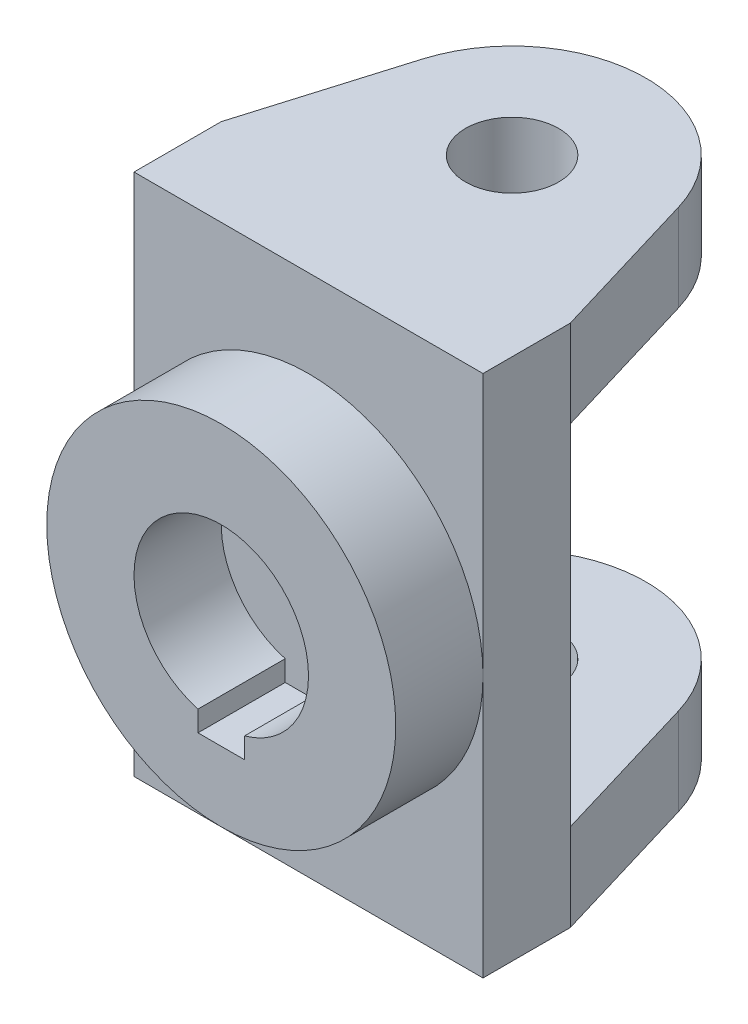
from build123d import *

# Parameters (mm, degrees)
SKETCH1_W           = 60
SKETCH1_H           = 90
BOSS_EXTRUDE1_DEPTH = 15
SKETCH2_R           = 30
BOSS_EXTRUDE2_DEPTH = 15
SKETCH3_R           = 8
BOSS_EXTRUDE3_DEPTH = 15


with BuildPart() as part:
    # Sketch1 → Boss-Extrude1 (new body)
    with BuildSketch(Plane.XY):
        Rectangle(SKETCH1_W, SKETCH1_H)
    extrude(amount=BOSS_EXTRUDE1_DEPTH)

    # Sketch2 → Boss-Extrude2 (add)
    with BuildSketch(Plane.XY.offset(15)):
        Circle(SKETCH2_R)
        with BuildLine():
            Line((-4, -14.456832295), (-4, -18))
            Line((-4, -18), (4, -18))
            Line((4, -18), (4, -14.456832295))
            ThreePointArc((4, -14.456832295), (0, 15), (-4, -14.456832295))
        make_face(mode=Mode.SUBTRACT)
    extrude(amount=BOSS_EXTRUDE2_DEPTH)

    # Sketch3 → Boss-Extrude3 (add)
    with BuildSketch(Plane(origin=(0, 45, 0), x_dir=(1, 0, 0), z_dir=(0, 1, 0))):
        with BuildLine():
            Line((30, 0), (22.03289839, 26.599347585))
            ThreePointArc((22.03289839, 26.599347585), (0, 43), (-22.03289839, 26.599347585))
            Line((-22.03289839, 26.599347585), (-30, 0))
            Line((-30, 0), (30, 0))
        make_face()
        with Locations(Location((0, 20, 0), (0, 0, 180))):
            Circle(SKETCH3_R, mode=Mode.SUBTRACT)
    boss_extrude3 = extrude(amount=-BOSS_EXTRUDE3_DEPTH)

    # Mirror1: Boss-Extrude3 across plane
    add(boss_extrude3.mirror(Plane.ZX))


solid = part.part
